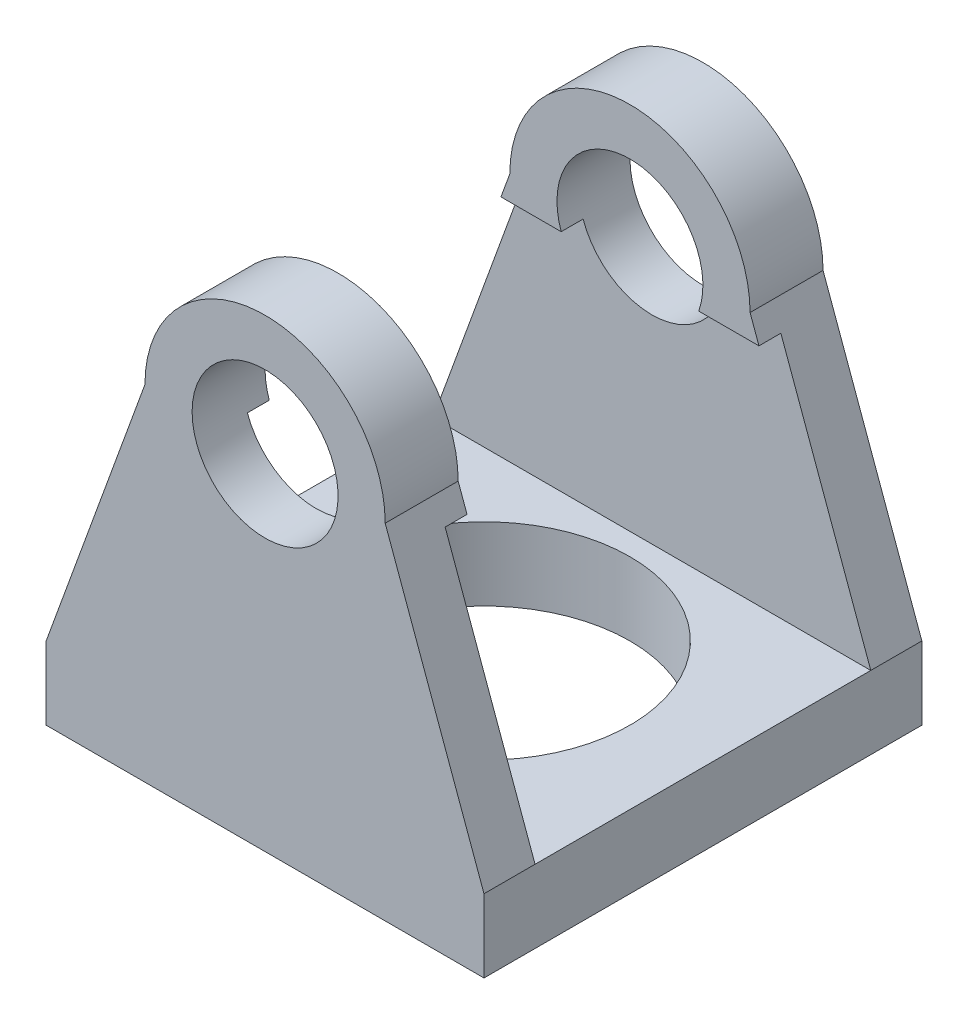
from build123d import *

# Parameters (mm, degrees)
SKETCH1_W           = 30
SKETCH1_H           = 30
BOSS_EXTRUDE1_DEPTH = 5
BOSS_EXTRUDE2_DEPTH = 5
BOSS_EXTRUDE3_START = -5
BOSS_EXTRUDE3_DEPTH = 5
SKETCH6_R           = 5
CUT_EXTRUDE1_DEPTH  = 38
SKETCH7_R           = 10
CUT_EXTRUDE2_DEPTH  = 5
SKETCH8_W           = 23.0008229
SKETCH8_H           = 16.927991413
CUT_EXTRUDE3_DEPTH  = 30


with BuildPart() as part:
    # Sketch1 → Boss-Extrude1 (new body)
    with BuildSketch(Plane(origin=(0, 0, 0), x_dir=(1, 0, 0), z_dir=(0, 1, 0))):
        Rectangle(SKETCH1_W, SKETCH1_H)
    extrude(amount=BOSS_EXTRUDE1_DEPTH)

    # Sketch3 → Boss-Extrude2 (add)
    with BuildSketch(Plane.XY.offset(15)):
        with BuildLine():
            Line((-15, 5), (-8.229784678, 23.601013721))
            ThreePointArc((-8.229784678, 23.601013721), (0, 31.830798399), (8.229784678, 23.601013721))
            Line((8.229784678, 23.601013721), (15, 5))
            Line((15, 5), (-15, 5))
        make_face()
    extrude(amount=-BOSS_EXTRUDE2_DEPTH)

    # Sketch5 → Boss-Extrude3 (add)
    with BuildSketch(Plane(origin=(0, 0, -15), x_dir=(-1, 0, 0), z_dir=(0, 0, -1)).offset(BOSS_EXTRUDE3_START)):
        with BuildLine():
            Line((-15, 5), (-8.229784678, 23.601013721))
            ThreePointArc((-8.229784678, 23.601013721), (0, 31.830798399), (8.229784678, 23.601013721))
            Line((8.229784678, 23.601013721), (15, 5))
            Line((15, 5), (-15, 5))
        make_face()
    extrude(amount=BOSS_EXTRUDE3_DEPTH)

    # Sketch6 → Cut-Extrude1 (cut)
    with BuildSketch(Plane(origin=(0, 0, -15), x_dir=(-1, 0, 0), z_dir=(0, 0, -1))):
        with Locations((0, 23.601013721)):
            Circle(SKETCH6_R)
    extrude(amount=-CUT_EXTRUDE1_DEPTH, mode=Mode.SUBTRACT)

    # Sketch7 → Cut-Extrude2 (cut)
    with BuildSketch(Plane.XZ):
        with Locations(Location((0, 0, 0), (0, 0, 270))):
            Circle(SKETCH7_R)
    extrude(amount=-CUT_EXTRUDE2_DEPTH, mode=Mode.SUBTRACT)

    # Sketch8 → Cut-Extrude3 (cut)
    with BuildSketch(Plane(origin=(15, 0, 0), x_dir=(0, 0, -1), z_dir=(1, 0, 0))):
        with Locations((0, 13.463995707)):
            Rectangle(SKETCH8_W, SKETCH8_H)
    extrude(amount=-CUT_EXTRUDE3_DEPTH, mode=Mode.SUBTRACT)


solid = part.part
